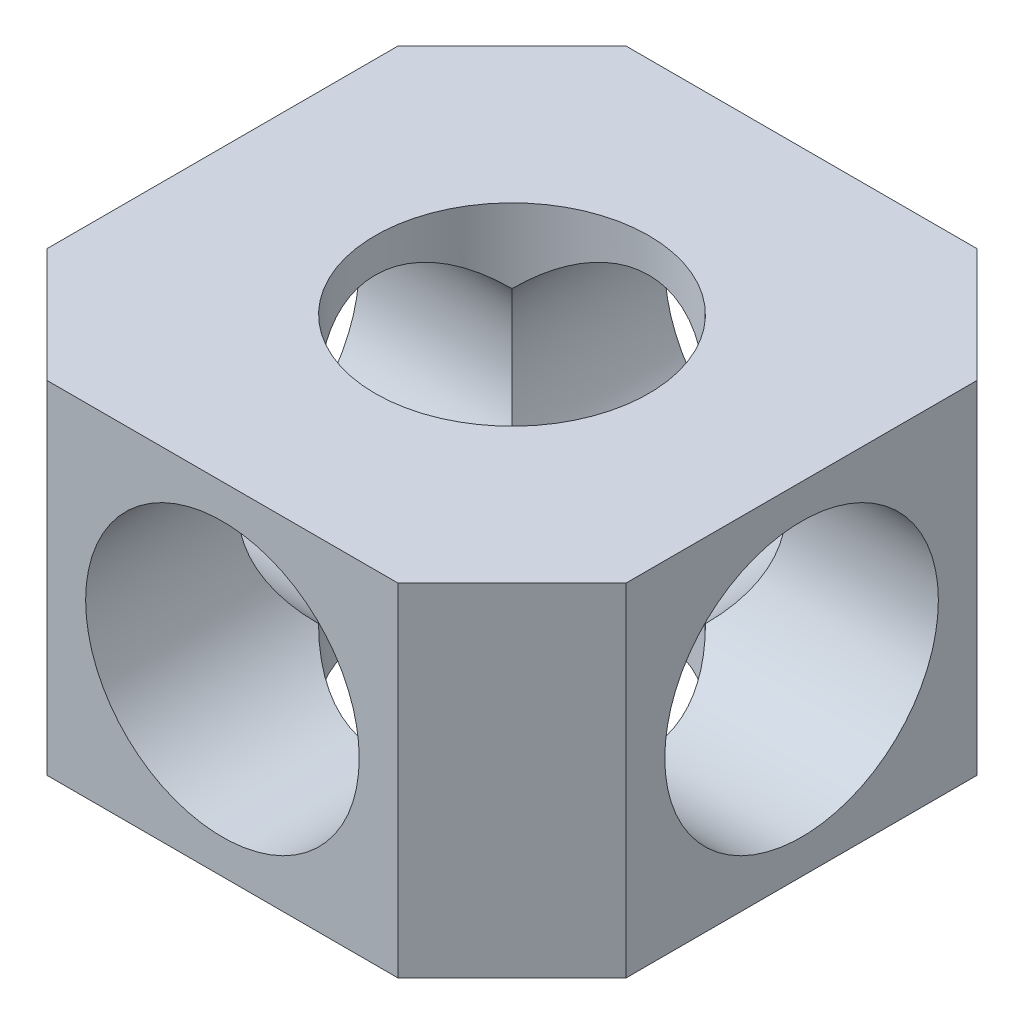
from build123d import *

# Parameters (mm, degrees)
SKETCH1_W           = 25.4
SKETCH1_H           = 25.4
BOSS_EXTRUDE1_DEPTH = 7.5
CHAMFER1_SIZE       = 5
SKETCH2_R           = 6
CUT_EXTRUDE1_DEPTH  = 24.400427347
SKETCH3_R           = 6
CUT_EXTRUDE2_DEPTH  = 30.37175514
CIRPATTERN1_COUNT   = 4


with BuildPart() as part:
    # Sketch1 → Boss-Extrude1 (new, symmetric)
    with BuildSketch(Plane(origin=(0, 0, 0), x_dir=(1, 0, 0), z_dir=(0, 1, 0))):
        Rectangle(SKETCH1_W, SKETCH1_H)
    extrude(amount=BOSS_EXTRUDE1_DEPTH, both=True)

    # Chamfer1
    chamfer1_edges = [part.edges().sort_by_distance(p)[0] for p in [
        (12.7, 0, 12.7),
        (-12.7, 0, 12.7),
        (-12.7, 0, -12.7),
        (12.7, 0, -12.7),
    ]]
    chamfer(chamfer1_edges, length=CHAMFER1_SIZE)

    # Sketch2 → Cut-Extrude1 (cut, through all)
    with BuildSketch(Plane(origin=(0, 7.5, 0), x_dir=(1, 0, 0), z_dir=(0, 1, 0))):
        with Locations(Location((0, 0, 0), (0, 0, 270))):
            Circle(SKETCH2_R)
    extrude(amount=-CUT_EXTRUDE1_DEPTH, mode=Mode.SUBTRACT)

    # Sketch3 → Cut-Extrude2 (cut, through all)
    with BuildSketch(Plane.XY.offset(12.7)):
        Circle(SKETCH3_R)
    cut_extrude2 = extrude(amount=-CUT_EXTRUDE2_DEPTH, mode=Mode.SUBTRACT)

    # CirPattern1: Cut-Extrude2 ×4 about axis
    cirpattern1_axis = Axis((0, -7.5, 0), (0, 1, 0))
    for i in range(1, CIRPATTERN1_COUNT):
        add(cut_extrude2.rotate(cirpattern1_axis, i * 360 / CIRPATTERN1_COUNT), mode=Mode.SUBTRACT)


solid = part.part
